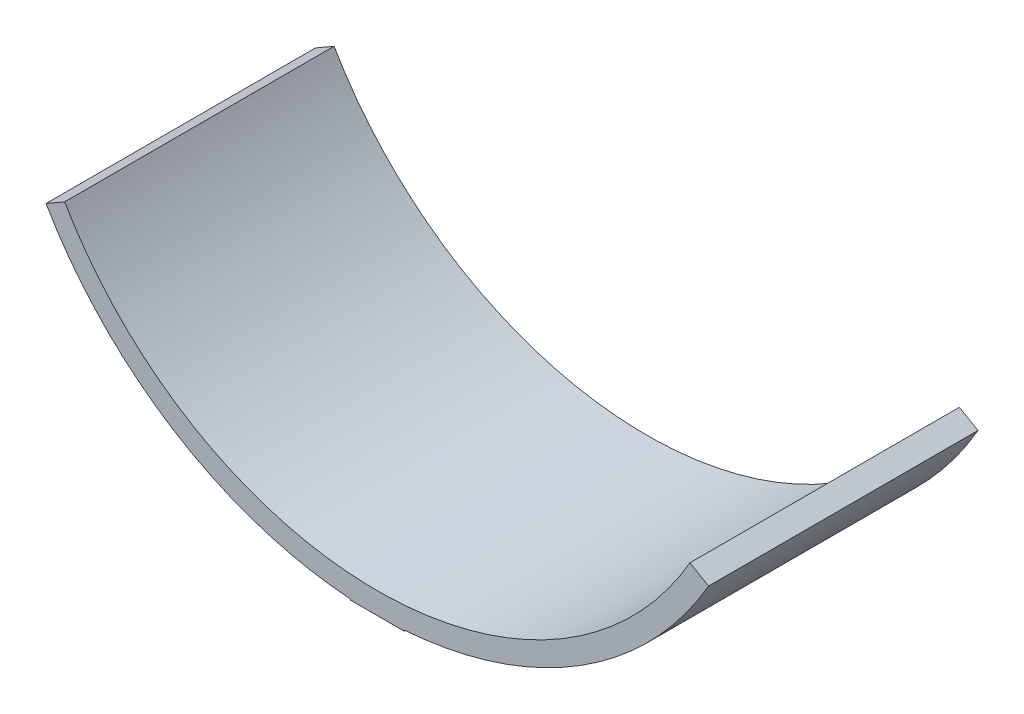
from build123d import *

# Parameters (mm, degrees)
SKETCH1_W           = 12.7
SKETCH1_H           = 5.08
BOSS_EXTRUDE1_DEPTH = 63.5
SKETCH2_W           = 5.334
SKETCH2_H           = 30.734
CUT_EXTRUDE1_DEPTH  = 3.175


with BuildPart() as part:
    # Sketch1 → Boss-Extrude1 (new body)
    with BuildSketch(Plane.XY):
        Rectangle(SKETCH1_W, SKETCH1_H)
        with BuildLine():
            Line((-73.690101608, 45.085), (-78.089510659, 42.545))
            ThreePointArc((-78.089510659, 42.545), (0, -2.54), (78.089510659, 42.545))
            Line((78.089510659, 42.545), (73.690101608, 45.085))
            ThreePointArc((73.690101608, 45.085), (0, 2.54), (-73.690101608, 45.085))
        make_face()
    extrude(amount=BOSS_EXTRUDE1_DEPTH)

    # Sketch2 → Cut-Extrude1 (cut)
    with BuildSketch(Plane.XZ.offset(2.54)):
        with Locations((0.1143, 40.64)):
            Rectangle(SKETCH2_W, SKETCH2_H)
    extrude(amount=-CUT_EXTRUDE1_DEPTH, mode=Mode.SUBTRACT)


solid = part.part
